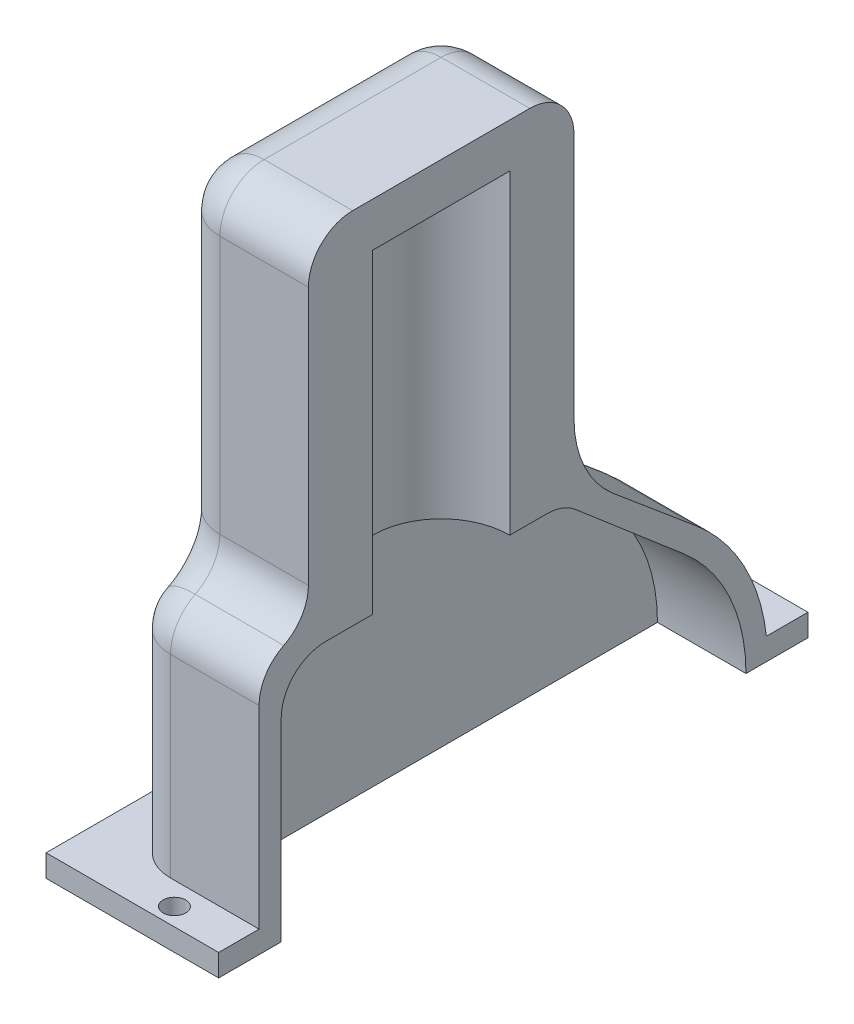
from build123d import *

# Parameters (mm, degrees)
BOSS_EXTRUDE1_DEPTH   = 120
FILLET1_R             = 20
FILLET2_R             = 20
SKETCH2_W             = 18
SKETCH2_H             = 103
BOSS_EXTRUDE2_DEPTH   = 10
F_1_0MM_DOWEL_HOLE1_D = 10.2
F_1_0MM_DOWEL_HOLE2_D = 10.2
SKETCH7_R             = 31
CUT_EXTRUDE1_DEPTH    = 250
CUT_EXTRUDE2_DEPTH    = 40
BOSS_EXTRUDE3_START   = -20
BOSS_EXTRUDE3_DEPTH   = 20
SKETCH12_W            = 357.858152506
SKETCH12_H            = 320.052587915
CUT_EXTRUDE3_DEPTH    = 78


with BuildPart() as part:
    # Sketch1 → Boss-Extrude1 (new body)
    with BuildSketch(Plane(origin=(0, 0, 0), x_dir=(0, 0, -1), z_dir=(1, 0, 0))):
        with BuildLine():
            Line((0, 0), (0, 10))
            Line((0, 10), (18, 10))
            Line((18, 10), (18, 97.5))
            ThreePointArc((18, 97.5), (21.013571696, 108.05752118), (29.146125346, 115.433457659))
            ThreePointArc((29.146125346, 115.433457659), (37.278678997, 122.809394139), (40.292250693, 133.366915319))
            Line((40.292250693, 133.366915319), (40.292250693, 250))
            ThreePointArc((40.292250693, 250), (46.150115069, 264.142135624), (60.292250693, 270))
            Line((60.292250693, 270), (140.292250693, 270))
            ThreePointArc((140.292250693, 270), (154.434386317, 264.142135624), (160.292250693, 250))
            Line((160.292250693, 250), (160.292250693, 138.688740716))
            ThreePointArc((160.292250693, 138.688740716), (164.976861341, 117.557827629), (178.152870209, 100.38651856))
            Line((178.152870209, 100.38651856), (215.624604805, 68.943999881))
            ThreePointArc((215.624604805, 68.943999881), (237.098685885, 42.515288741), (247.216439033, 10))
            Line((247.216439033, 10), (266, 10))
            Line((266, 10), (266, 0))
            Line((266, 0), (147.773719933, 0))
            ThreePointArc((147.773719933, 0), (128, 23), (108.226280067, 0))
            Line((108.226280067, 0), (0, 0))
        make_face()
    extrude(amount=BOSS_EXTRUDE1_DEPTH)

    # Fillet1
    fillet1_edges = [part.edges().sort_by_distance(p)[0] for p in [
        (120, 42.515288741, -237.098685885),
        (120, 84.66525922, -196.888737507),
        (120, 117.557827629, -164.976861341),
        (120, 194.344370358, -160.292250693),
        (120, 264.142135624, -154.434386317),
        (120, 270, -100.292250693),
        (120, 264.142135624, -46.150115069),
        (120, 191.683457659, -40.292250693),
        (120, 122.809394139, -37.278678997),
        (120, 108.05752118, -21.013571696),
        (120, 53.75, -18),
    ]]
    fillet(fillet1_edges, radius=FILLET1_R)

    # Fillet2
    fillet2_edges = [part.edges().sort_by_distance(p)[0] for p in [
        (0, 53.75, -18),
        (0, 108.05752118, -21.013571696),
        (0, 122.809394139, -37.278678997),
        (0, 191.683457659, -40.292250693),
        (0, 264.142135624, -46.150115069),
        (0, 270, -100.292250693),
        (0, 264.142135624, -154.434386317),
        (0, 194.344370358, -160.292250693),
        (0, 117.557827629, -164.976861341),
        (0, 84.66525922, -196.888737507),
        (0, 42.515288741, -237.098685885),
    ]]
    fillet(fillet2_edges, radius=FILLET2_R)

    # Sketch2 → Boss-Extrude2 (add)
    with BuildSketch(Plane(origin=(0, 10, 0), x_dir=(1, 0, 0), z_dir=(0, 1, 0))):
        Polygon((-17.998263805, -0.25), (138, -0.25), (138, 93.5), (120, 93.5), (120, 0), (0, 0), (0, 265.971156308), (-17.998263805, 266), align=None)
        with Locations((129, 214.5)):
            Rectangle(SKETCH2_W, SKETCH2_H)
    extrude(amount=-BOSS_EXTRUDE2_DEPTH)

    # Ø1.0mm Dowel Hole1 (through all)
    with Locations(Plane(origin=(0, 10, 0), x_dir=(1, 0, 0), z_dir=(0, 1, 0))):
        with Locations((32.001736195, 258), (82.001736195, 258)):
            Hole(F_1_0MM_DOWEL_HOLE1_D / 2)

    # Ø1.0mm Dowel Hole2 (through all)
    with Locations(Plane(origin=(0, 10, 0), x_dir=(1, 0, 0), z_dir=(0, 1, 0))):
        with Locations((-9.998263805, 205.75), (-9.998263805, 135.75), (-9.998263805, 65.75), (32.001736195, 7.75), (82.001736195, 7.75), (130, 65.75), (130, 205.75)):
            Hole(F_1_0MM_DOWEL_HOLE2_D / 2)

    # Sketch7 → Cut-Extrude1 (cut)
    with BuildSketch(Plane.XZ):
        with Locations(Location((60.001736195, -100.29, 0), (0, 0, 270))):
            Circle(SKETCH7_R)
    extrude(amount=-CUT_EXTRUDE1_DEPTH, mode=Mode.SUBTRACT)

    # Sketch9 → Cut-Extrude2 (cut, symmetric)
    with BuildSketch(Plane(origin=(60, 0, 0), x_dir=(0, 0, -1), z_dir=(1, 0, 0))):
        with BuildLine():
            Line((28, 0), (28, 87.5))
            ThreePointArc((28, 87.5), (33.857864376, 101.642135624), (48, 107.5))
            Line((48, 107.5), (148, 107.5))
            ThreePointArc((148, 107.5), (154.928315168, 106.261621703), (160.998642822, 102.699844894))
            Line((160.998642822, 102.699844894), (209.994571286, 60.799379576))
            ThreePointArc((209.994571286, 60.799379576), (230.662114279, 33.469645181), (238, 0))
            Line((238, 0), (158, 0))
            Line((158, 0), (147.773719933, 0))
            ThreePointArc((147.773719933, 0), (128, 23), (108.226280067, 0))
            Line((108.226280067, 0), (28, 0))
        make_face()
    extrude(amount=CUT_EXTRUDE2_DEPTH, both=True, mode=Mode.SUBTRACT)

    # Sketch10 → Boss-Extrude3 (add)
    with BuildSketch(Plane(origin=(20, 0, 0), x_dir=(0, 0, -1), z_dir=(1, 0, 0)).offset(BOSS_EXTRUDE3_START)):
        with BuildLine():
            ThreePointArc((148, 3), (128, 23), (108, 3))
            Line((108, 3), (148, 3))
        make_face()
        with BuildLine():
            ThreePointArc((108, 3), (108.056650248, 1.495739163), (108.226280067, 0))
            Line((108.226280067, 0), (147.773719933, 0))
            ThreePointArc((147.773719933, 0), (147.943349752, 1.495739163), (148, 3))
            Line((148, 3), (108, 3))
        make_face()
    extrude(amount=BOSS_EXTRUDE3_DEPTH)

    # Sketch12 → Cut-Extrude3 (cut)
    with BuildSketch(Plane(origin=(138, 0, 0), x_dir=(0, 0, -1), z_dir=(1, 0, 0))):
        with Locations((133.670062861, 122.61081936)):
            Rectangle(SKETCH12_W, SKETCH12_H)
    extrude(amount=-CUT_EXTRUDE3_DEPTH, mode=Mode.SUBTRACT)


solid = part.part
